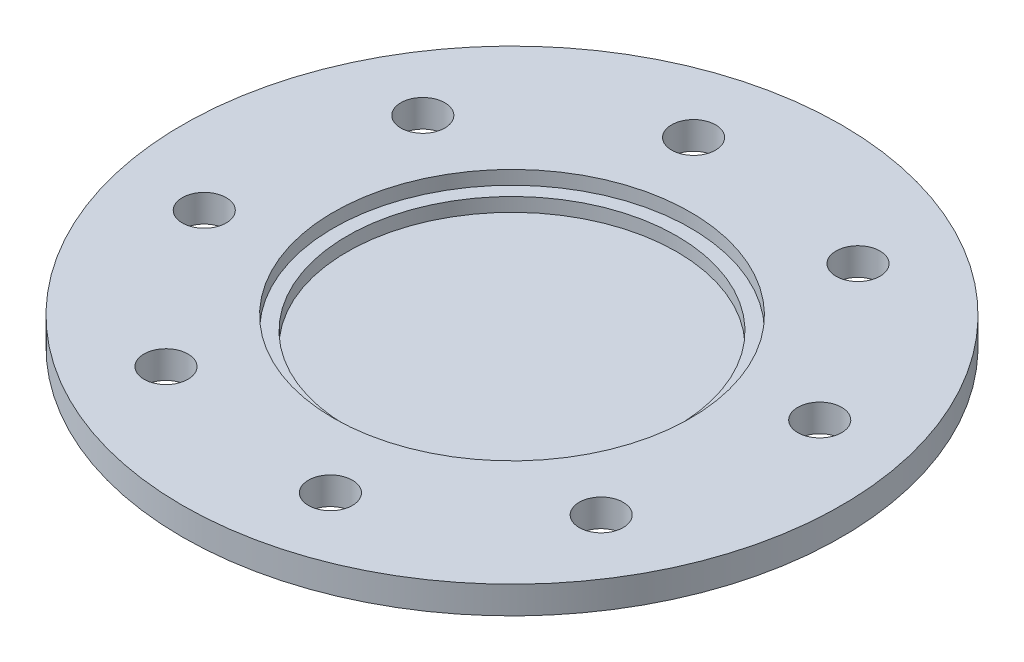
from build123d import *

# Parameters (mm, degrees)
SKETCH1_W          = 60
SKETCH1_H          = 10
SKETCH2_R          = 8
CUT_EXTRUDE1_DEPTH = 171
CIRPATTERN1_COUNT  = 8


with BuildPart() as part:
    # Sketch1 → Revolve1 (revolve)
    with BuildSketch(Plane.XY, mode=Mode.PRIVATE) as revolve1_sk:
        with BuildLine():
            ThreePointArc((75, 31.286171589), (71.464466094, 29.821705495), (70, 26.286171589))
            Line((70, 26.286171589), (70, 21.286171589))
            Line((70, 21.286171589), (60, 21.286171589))
            Line((60, 21.286171589), (60, 36.286171589))
            Line((60, 36.286171589), (65, 36.286171589))
            Line((65, 36.286171589), (65, 41.286171589))
            Line((65, 41.286171589), (120, 41.286171589))
            Line((120, 41.286171589), (120, 31.286171589))
            Line((120, 31.286171589), (75, 31.286171589))
        make_face()
        with Locations((30, 26.286171589)):
            Rectangle(SKETCH1_W, SKETCH1_H)
    revolve(revolve1_sk.sketch.rotate(Axis((0, 97.731625762, 0), (0, -1, 0)), 90), axis=Axis((0, 97.731625762, 0), (0, -1, 0)))

    # Sketch2 → Cut-Extrude1 (cut, through all)
    with BuildSketch(Plane.XZ.offset(-31.286171589)):
        with Locations(Location((79.233979131, 46.754428144, 0), (0, 0, 270))):
            Circle(SKETCH2_R)
    cut_extrude1 = extrude(amount=-CUT_EXTRUDE1_DEPTH, mode=Mode.SUBTRACT)

    # CirPattern1: Cut-Extrude1 ×8 about axis
    cirpattern1_axis = Axis((0, 0, 0), (0, 1, 0))
    for i in range(1, CIRPATTERN1_COUNT):
        add(cut_extrude1.rotate(cirpattern1_axis, i * 360 / CIRPATTERN1_COUNT), mode=Mode.SUBTRACT)


solid = part.part
